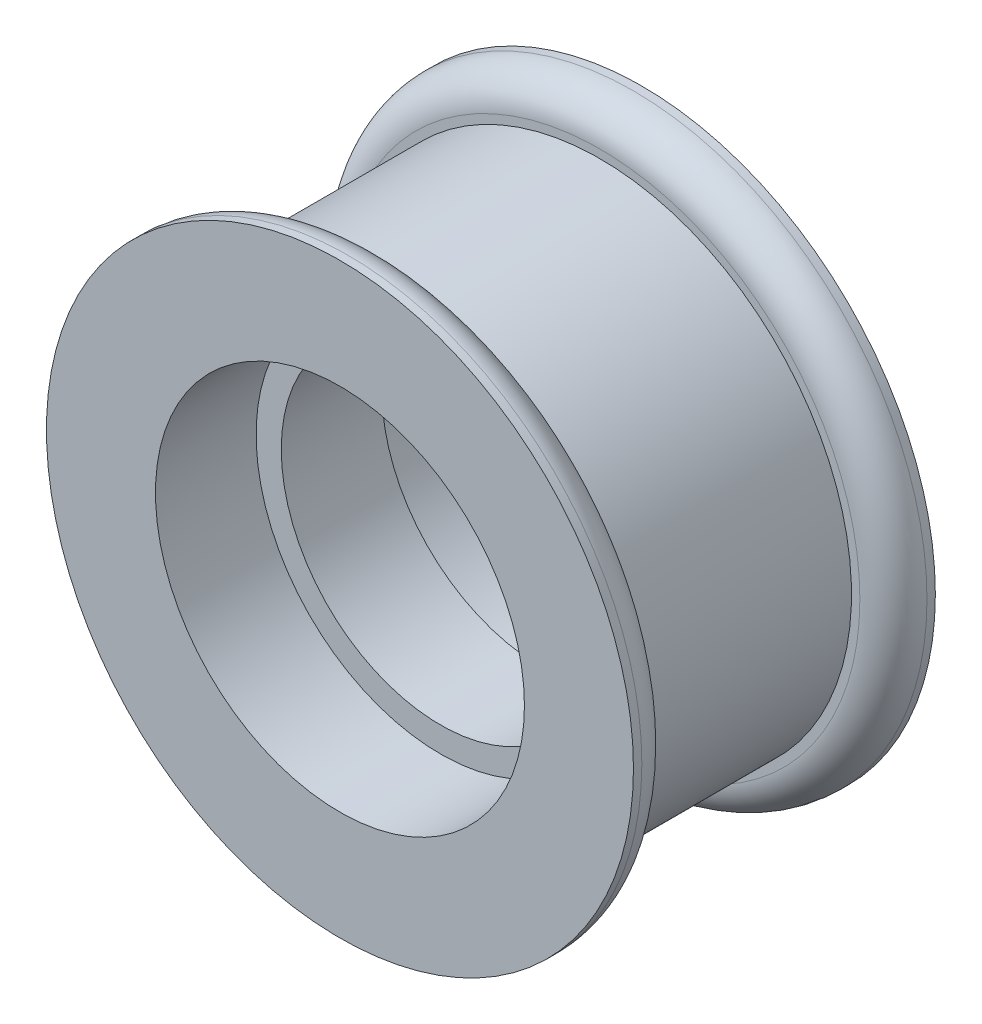
from build123d import *

# Parameters (mm, degrees)
SKETCH_1_R          = 15
EXTRUDE_1_DEPTH     = 6.5
SKETCH_2_R          = 17.5
EXTRUDE_2_DEPTH     = 2.5
SKETCH_3_R          = 11
CUT_EXTRUDE_1_DEPTH = 6
CUT_EXTRUDE_START   = -6
SKETCH_4_R          = 11
CUT_EXTRUDE_2_DEPTH = 6
SKETCH_5_R          = 9.5
CUT_EXTRUDE_3_DEPTH = 28.504545079
FILLET_1_R          = 2


with BuildPart() as part:
    # 草图1 → 拉伸1 (new, symmetric)
    with BuildSketch(Plane.XY):
        with Locations(Location((0, 0, 0), (0, 0, 180))):
            Circle(SKETCH_1_R)
    extrude(amount=EXTRUDE_1_DEPTH, both=True)

    # 草图2 → 拉伸2 (add)
    with BuildSketch(Plane.XY.offset(6.5)):
        Circle(SKETCH_2_R)
    extrude_2 = extrude(amount=EXTRUDE_2_DEPTH)

    # 镜向1: 拉伸2 across plane
    add(extrude_2.mirror(Plane.XY))

    # 草图3 → 切除-拉伸1 (cut)
    with BuildSketch(Plane.XY.offset(9)):
        Circle(SKETCH_3_R)
    extrude(amount=-CUT_EXTRUDE_1_DEPTH, mode=Mode.SUBTRACT)

    # 草图4 → 切除-拉伸2 (cut)
    with BuildSketch(Plane(origin=(0, 0, -9), x_dir=(-1, 0, 0), z_dir=(0, 0, -1)).offset(CUT_EXTRUDE_START)):
        with Locations(Location((0, 0, 0), (0, 0, 180))):
            Circle(SKETCH_4_R)
    extrude(amount=CUT_EXTRUDE_2_DEPTH, mode=Mode.SUBTRACT)

    # 草图5 → 切除-拉伸3 (cut, through all)
    with BuildSketch(Plane(origin=(0, 0, -3), x_dir=(-1, 0, 0), z_dir=(0, 0, -1))):
        Circle(SKETCH_5_R)
    extrude(amount=-CUT_EXTRUDE_3_DEPTH, mode=Mode.SUBTRACT)

    # 圆角1
    fillet_1_edges = [part.edges().sort_by_distance(p)[0] for p in [
        (-17.5, 0, 6.5),
        (-17.5, 0, -6.5),
    ]]
    fillet(fillet_1_edges, radius=FILLET_1_R)


solid = part.part
